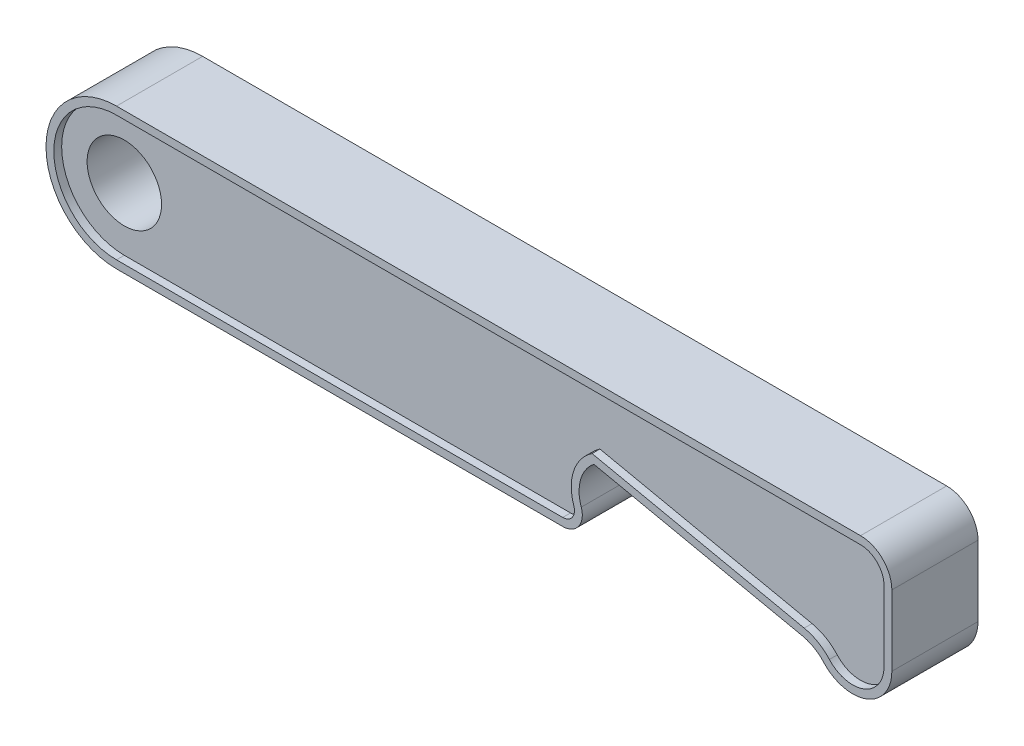
from build123d import *

# Parameters (mm, degrees)
SKETCH2_R           = 4.75
BOSS_EXTRUDE1_DEPTH = 11
CUT_EXTRUDE1_DEPTH  = 1


with BuildPart() as part:
    # Sketch2 → Boss-Extrude1 (new body)
    with BuildSketch(Plane.XY):
        with BuildLine():
            Line((0, -9), (56.97881801, -9))
            ThreePointArc((56.97881801, -9), (59.015853911, -7.949304916), (59.340646926, -5.680387791))
            ThreePointArc((59.340646926, -5.680387791), (59.261907809, -2.649407806), (60.949113688, -0.130206379))
            Line((60.949113688, -0.130206379), (87.603863211, -5.795848289))
            ThreePointArc((87.603863211, -5.795848289), (89.065679287, -6.35725315), (90.282152379, -7.343293147))
            ThreePointArc((90.282152379, -7.343293147), (95.79035777, -8.66847074), (99, -4))
            Line((99, -4), (99, 5))
            ThreePointArc((99, 5), (97.828427125, 7.828427125), (95, 9))
            Line((95, 9), (0, 9))
            ThreePointArc((0, 9), (-9, 0), (0, -9))
        make_face()
        Circle(SKETCH2_R, mode=Mode.SUBTRACT)
    extrude(amount=BOSS_EXTRUDE1_DEPTH)

    # Sketch4 → Cut-Extrude1 (cut)
    with BuildSketch(Plane.XY.offset(11)):
        with BuildLine():
            Line((60.720530375, 0.940721099), (87.811774902, -4.817700689))
            ThreePointArc((87.811774902, -4.817700689), (89.565954193, -5.491386522), (91.025721903, -6.674634517))
            ThreePointArc((91.025721903, -6.674634517), (95.432286216, -7.734776592), (98, -4))
            Line((98, -4), (98, 5))
            ThreePointArc((98, 5), (97.121320344, 7.121320344), (95, 8))
            Line((95, 8), (0, 8))
            ThreePointArc((0, 8), (-8, 0), (0, -8))
            Line((0, -8), (56.97881801, -8))
            ThreePointArc((56.97881801, -8), (58.201039551, -7.369582949), (58.39591536, -6.008232674))
            ThreePointArc((58.39591536, -6.008232674), (58.374246442, -2.137683304), (60.720530375, 0.940721099))
        make_face()
    extrude(amount=-CUT_EXTRUDE1_DEPTH, mode=Mode.SUBTRACT)


solid = part.part
